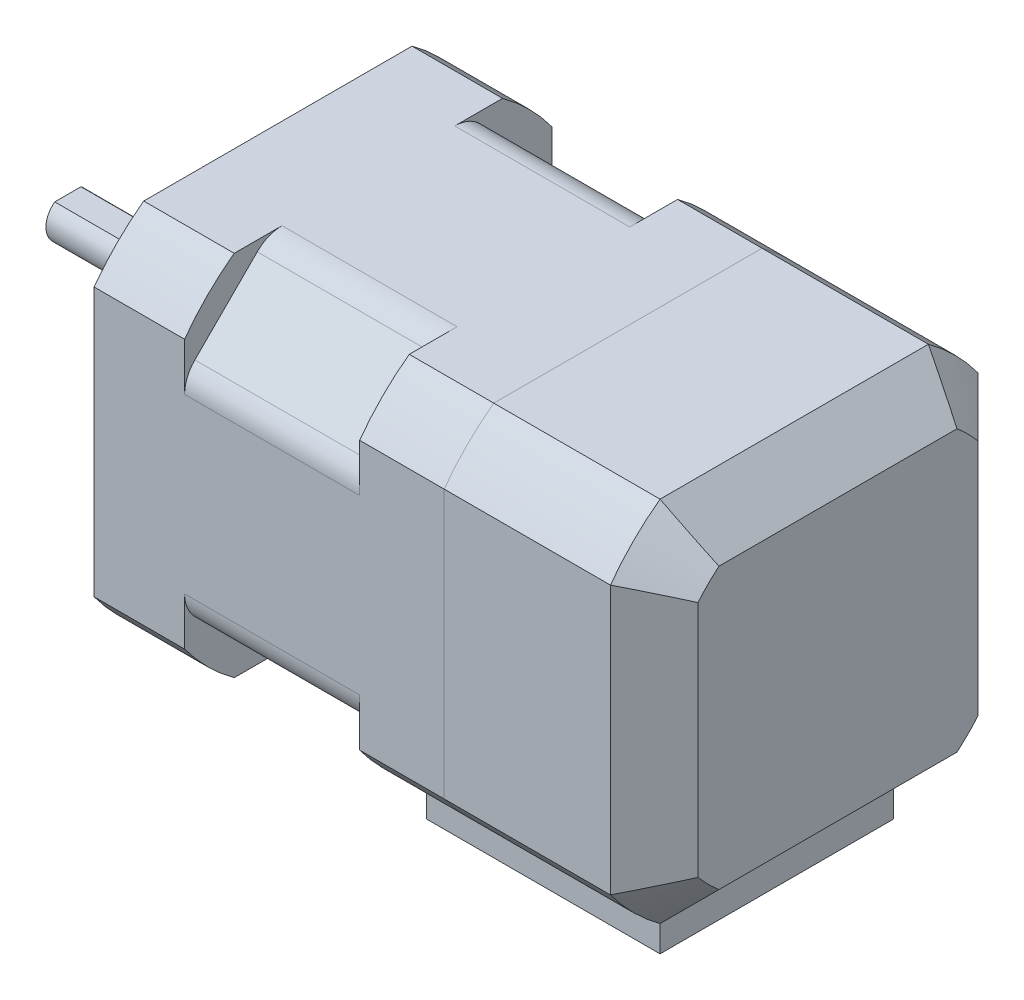
from build123d import *

# Parameters (mm, degrees)
ESQUISSE1_W                  = 42
ESQUISSE1_H                  = 42
BOSS_EXTRU_1_DEPTH           = 64
ESQUISSE2_R                  = 11
BOSS_EXTRU_2_DEPTH           = 2
ESQUISSE3_R                  = 2.5
BOSS_EXTRU_3_DEPTH           = 24
TROU_TARAUD_M31_D            = 2.5
TROU_TARAUD_M31_DEPTH        = 4
TROU_TARAUD_M31_TIP          = 0.751075774
ESQUISSE6_OUTSIDE_W          = 65.234
ESQUISSE6_OUTSIDE_H          = 65.234
ESQUISSE6_OUTSIDE_R          = 26
ENL_V_MAT_EXTRU_1_DEPTH      = 71.554943129
ENL_V_MAT_EXTRU_2_DEPTH      = 71.554943129
ENL_V_MAT_EXTRU_2_DEPTH_BACK = 71.554943129
CHANFREIN1_SIZE              = 5
ESQUISSE10_W                 = 26.659419434
ESQUISSE10_H                 = 26.659419434
BOSS_EXTRU_5_DEPTH           = 10
CHANFREIN2_SIZE              = 5
ESQUISSE11_OUTSIDE_W         = 66.102
ESQUISSE11_OUTSIDE_H         = 76.102
ENL_V_MAT_EXTRU_3_DEPTH      = 20
CONG_1_R                     = 4


with BuildPart() as part:
    # Esquisse1 → Boss.-Extru.1 (new body)
    with BuildSketch(Plane(origin=(0, 0, 0), x_dir=(0, 0, -1), z_dir=(1, 0, 0))):
        Rectangle(ESQUISSE1_W, ESQUISSE1_H)
    extrude(amount=BOSS_EXTRU_1_DEPTH)

    # Esquisse2 → Boss.-Extru.2 (add)
    with BuildSketch(Plane(origin=(0, 0, 0), x_dir=(0, 0, -1), z_dir=(1, 0, 0))):
        Circle(ESQUISSE2_R)
    extrude(amount=-BOSS_EXTRU_2_DEPTH)

    # Esquisse3 → Boss.-Extru.3 (add)
    with BuildSketch(Plane.ZY):
        with Locations(Location((0, 0, 0), (0, 0, 180))):
            Circle(ESQUISSE3_R)
    extrude(amount=BOSS_EXTRU_3_DEPTH)

    # Trou taraudé M31
    with Locations(Plane.ZY):
        with Locations((-15.5, 15.5), (15.5, 15.5), (-15.5, -15.5), (15.5, -15.5)):
            Hole(TROU_TARAUD_M31_D / 2, depth=TROU_TARAUD_M31_DEPTH)
            with Locations((0, 0, -(TROU_TARAUD_M31_DEPTH + TROU_TARAUD_M31_TIP / 2))):  # 118° drill point
                Cone(0, TROU_TARAUD_M31_D / 2, TROU_TARAUD_M31_TIP, mode=Mode.SUBTRACT)

    # Esquisse6 outside → Enlèv. mat.-Extru.1 (cut, through all)
    with BuildSketch(Plane(origin=(0, 0, 0), x_dir=(0, 0, -1), z_dir=(1, 0, 0))):
        Rectangle(ESQUISSE6_OUTSIDE_W, ESQUISSE6_OUTSIDE_H)
        Circle(ESQUISSE6_OUTSIDE_R, mode=Mode.SUBTRACT)
    extrude(amount=ENL_V_MAT_EXTRU_1_DEPTH, mode=Mode.SUBTRACT)

    # Esquisse7 → Enlèv. mat.-Extru.2 (cut, two sides: drawn at the far end of the back side and taken through both)
    with BuildSketch(Plane.XY.offset(-ENL_V_MAT_EXTRU_2_DEPTH_BACK)):
        Polygon((-215.91206667, 2), (-24, 2), (-9, 2), (-9, 2.5), (-9, 194.41206667), (-270.377319091, 475.486545052), (-477.289385761, 283.074478383), align=None)
    extrude(amount=ENL_V_MAT_EXTRU_2_DEPTH + ENL_V_MAT_EXTRU_2_DEPTH_BACK, mode=Mode.SUBTRACT)

    # Chanfrein1
    chanfrein1_edges = [part.edges().sort_by_distance(p)[0] for p in [
        (64, 0, 21),
        (64, -21, 0),
        (64, 0, -21),
        (64, 21, 0),
        (64, -18.384776311, 18.384776311),
        (64, 18.384776311, 18.384776311),
        (64, -18.384776311, -18.384776311),
        (64, 18.384776311, -18.384776311),
    ]]
    chamfer(chanfrein1_edges, length=CHANFREIN1_SIZE)

    # Esquisse10 → Boss.-Extru.5 (add)
    with BuildSketch(Plane.XZ.offset(21)):
        with Locations((43.670290283, 0)):
            Rectangle(ESQUISSE10_W, ESQUISSE10_H)
    extrude(amount=BOSS_EXTRU_5_DEPTH)

    # Chanfrein2
    chanfrein2_edges = [part.edges().sort_by_distance(p)[0] for p in [
        (57, -31, 0),
        (43.670290283, -31, 13.329709717),
        (43.670290283, -31, -13.329709717),
    ]]
    chamfer(chanfrein2_edges, length=CHANFREIN2_SIZE)

    # Esquisse11 outside → Enlèv. mat.-Extru.3 (cut)
    with BuildSketch(Plane.ZY.offset(-30.340580566)):
        with Locations((0, -5)):
            Rectangle(ESQUISSE11_OUTSIDE_W, ESQUISSE11_OUTSIDE_H)
        Polygon((0, 32.526911935), (-32.526911935, 0), (0, -32.526911935), (32.526911935, 0), align=None, mode=Mode.SUBTRACT)
    extrude(amount=ENL_V_MAT_EXTRU_3_DEPTH, mode=Mode.SUBTRACT)

    # Congé1
    cong_1_edges = [part.edges().sort_by_distance(p)[0] for p in [
        (20.340580566, 21, -11.526911935),
        (20.340580566, 21, 11.526911935),
        (20.340580566, 11.526911935, 21),
        (20.340580566, 11.526911935, -21),
        (20.340580566, -21, -11.526911935),
        (20.340580566, -11.526911935, -21),
        (20.340580566, -21, 11.526911935),
        (20.340580566, -11.526911935, 21),
    ]]
    fillet(cong_1_edges, radius=CONG_1_R)


solid = part.part
